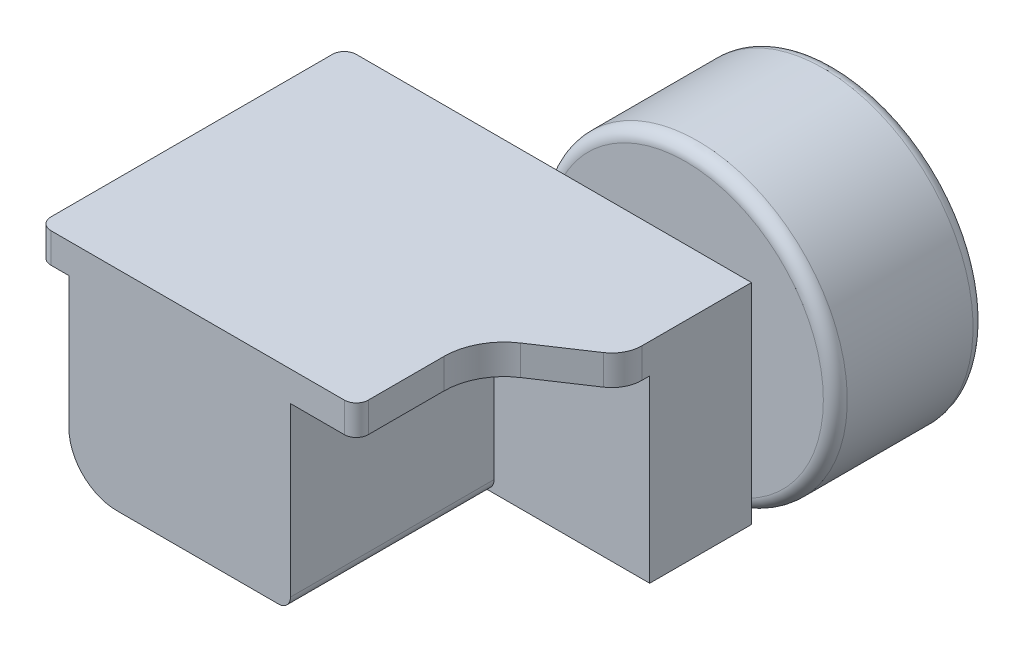
from build123d import *

# Parameters (mm, degrees)
ESQUISSE1_W             = 68
ESQUISSE1_H             = 35
BOSS_EXTRU_1_DEPTH      = 51
ESQUISSE2_R             = 6
BOSS_EXTRU_2_DEPTH      = 7
ESQUISSE3_R             = 25
BOSS_EXTRU_3_DEPTH      = 25
ENL_V_START             = -7
ESQUISSE4_R             = 18
ESQUISSE4_R_2           = 6
ENL_V_MAT_EXTRU_1_DEPTH = 7
CONG_1_R                = 2
ENL_V_MAT_EXTRU_2_DEPTH = 100.949987536
CONG_2_R                = 5
ESQUISSE7_W             = 26
ESQUISSE7_H             = 34
ENL_V_MAT_EXTRU_3_DEPTH = 30
ENL_V_MAT_EXTRU_4_DEPTH = 30
CONG_3_R                = 8
CONG_4_R                = 2
CONG_5_R                = 2


with BuildPart() as part:
    # Esquisse1 → Boss.-Extru.1 (new body)
    with BuildSketch(Plane.XY):
        with Locations((34, 17.5)):
            Rectangle(ESQUISSE1_W, ESQUISSE1_H)
    extrude(amount=BOSS_EXTRU_1_DEPTH)

    # Esquisse2 → Boss.-Extru.2 (add)
    with BuildSketch(Plane(origin=(0, 0, 0), x_dir=(-1, 0, 0), z_dir=(0, 0, -1))):
        with Locations((-50, 17)):
            Circle(ESQUISSE2_R)
    extrude(amount=BOSS_EXTRU_2_DEPTH)

    # Esquisse3 → Boss.-Extru.3 (add)
    with BuildSketch(Plane(origin=(0, 0, -7), x_dir=(-1, 0, 0), z_dir=(0, 0, -1))):
        with Locations((-50, 17)):
            Circle(ESQUISSE3_R)
    extrude(amount=BOSS_EXTRU_3_DEPTH)

    # Esquisse4 → Enlèv. mat.-Extru.1 (cut)
    with BuildSketch(Plane(origin=(0, 0, -32), x_dir=(-1, 0, 0), z_dir=(0, 0, -1)).offset(ENL_V_START)):
        with Locations((-50, 17)):
            Circle(ESQUISSE4_R)
        with Locations((-50, 17)):
            Circle(ESQUISSE4_R_2, mode=Mode.SUBTRACT)
    extrude(amount=ENL_V_MAT_EXTRU_1_DEPTH, mode=Mode.SUBTRACT)

    # Congé1
    cong_1_edges = [part.edges().sort_by_distance(p)[0] for p in [
        (75, 17, -7),
        (75, 17, -32),
        (68, 17, -25),
        (56, 17, -25),
        (68, 17, -32),
        (56, 17, -32),
    ]]
    fillet(cong_1_edges, radius=CONG_1_R)

    # Esquisse6 → Enlèv. mat.-Extru.2 (cut, through all)
    with BuildSketch(Plane(origin=(0, 0, 0), x_dir=(-1, 0, 0), z_dir=(0, -1, 0))):
        with BuildLine():
            Line((-53, -51), (-53, -36.351837585))
            ThreePointArc((-53, -36.351837585), (-54.183254012, -31.63325833), (-57.452998038, -28.031334642))
            Line((-57.452998038, -28.031334642), (-68, -21))
            Line((-68, -21), (-68, -51))
            Line((-68, -51), (-53, -51))
        make_face()
    extrude(amount=-ENL_V_MAT_EXTRU_2_DEPTH, mode=Mode.SUBTRACT)

    # Congé2
    cong_2_edges = [part.edges().sort_by_distance(p)[0] for p in [
        (68, 17.5, 21),
    ]]
    fillet(cong_2_edges, radius=CONG_2_R)

    # Esquisse7 → Enlèv. mat.-Extru.3 (cut)
    with BuildSketch(Plane.XZ):
        with Locations((55, 34)):
            Rectangle(ESQUISSE7_W, ESQUISSE7_H)
    extrude(amount=-ENL_V_MAT_EXTRU_3_DEPTH, mode=Mode.SUBTRACT)

    # Esquisse8 → Enlèv. mat.-Extru.4 (cut)
    with BuildSketch(Plane.XZ):
        Polygon((0, 0), (13, 0), (13, 14), (5, 14), (5, 51), (0, 51), align=None)
    extrude(amount=-ENL_V_MAT_EXTRU_4_DEPTH, mode=Mode.SUBTRACT)

    # Congé3
    cong_3_edges = [part.edges().sort_by_distance(p)[0] for p in [
        (5, 0, 32.5),
    ]]
    fillet(cong_3_edges, radius=CONG_3_R)

    # Congé4
    cong_4_edges = [part.edges().sort_by_distance(p)[0] for p in [
        (42, 0, 34),
    ]]
    fillet(cong_4_edges, radius=CONG_4_R)

    # Congé5
    cong_5_edges = [part.edges().sort_by_distance(p)[0] for p in [
        (0, 32.5, 51),
        (0, 32.5, 0),
        (53, 32.5, 51),
    ]]
    fillet(cong_5_edges, radius=CONG_5_R)


solid = part.part
